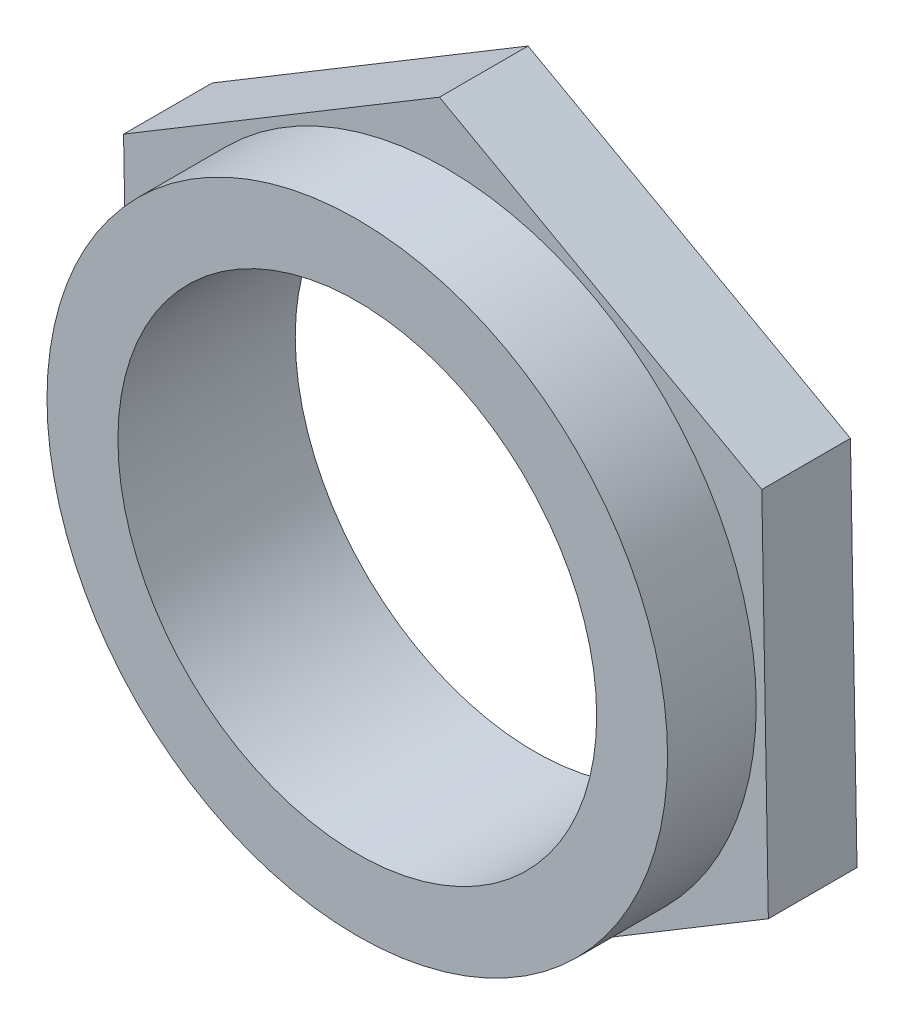
from build123d import *

# Parameters (mm, degrees)
BOSS_EXTRUDE1_DEPTH         = 2
SKETCH4_R                   = 7
BOSS_EXTRUDE2_DEPTH         = 2
M12X1_25_TAPPED_HOLE2_D     = 10.8
M12X1_25_TAPPED_HOLE2_DEPTH = 8.75
M12X1_25_TAPPED_HOLE2_TIP   = 3.244647343


with BuildPart() as part:
    # Sketch1 → Boss-Extrude1 (new body)
    with BuildSketch(Plane.XY):
        Polygon((-7.272664144, 4.028443403), (-7.125066396, -4.284090201), (0.147597748, -8.312533603), (7.272664144, -4.028443403), (7.125066396, 4.284090201), (-0.147597748, 8.312533603), align=None)
    extrude(amount=BOSS_EXTRUDE1_DEPTH)

    # Sketch4 → Boss-Extrude2 (add)
    with BuildSketch(Plane.XY.offset(2)):
        Circle(SKETCH4_R)
    extrude(amount=BOSS_EXTRUDE2_DEPTH)

    # M12x1.25 Tapped Hole2
    with Locations(Plane.XY.offset(4)):
        with Locations((0, 0)):
            Hole(M12X1_25_TAPPED_HOLE2_D / 2, depth=M12X1_25_TAPPED_HOLE2_DEPTH)
            with Locations((0, 0, -(M12X1_25_TAPPED_HOLE2_DEPTH + M12X1_25_TAPPED_HOLE2_TIP / 2))):  # 118° drill point
                Cone(0, M12X1_25_TAPPED_HOLE2_D / 2, M12X1_25_TAPPED_HOLE2_TIP, mode=Mode.SUBTRACT)


solid = part.part
